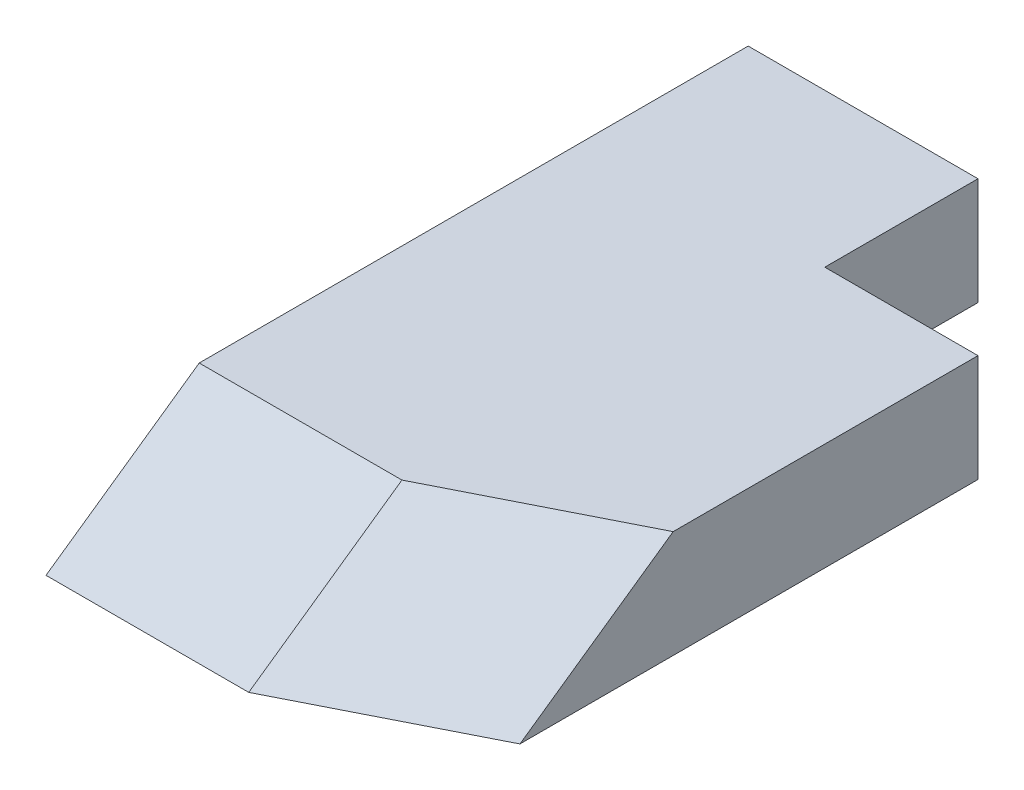
from build123d import *

# Parameters (mm, degrees)
BOSS_EXTRUDE1_DEPTH = 15
SKETCH6_R           = 26.898177411
CUT_EXTRUDE2_DEPTH  = 9
SKETCH7_W           = 12
SKETCH7_H           = 12
CUT_EXTRUDE3_DEPTH  = 10


with BuildPart() as part:
    # Sketch1 → Boss-Extrude1 (new, symmetric)
    with BuildSketch(Plane(origin=(0, 0, 0), x_dir=(0, 0, -1), z_dir=(1, 0, 0))):
        Polygon((-28, -7), (15, -7), (15, -15.402490459), (-40, -15.402490459), align=None)
    extrude(amount=BOSS_EXTRUDE1_DEPTH, both=True)

    # Sketch6 → Cut-Extrude2 (cut)
    with BuildSketch(Plane(origin=(2.825070642, 7.997590477, 5.599973139), x_dir=(-0.9605940806562516, 0.22768745094625853, 0.1594284695083218), z_dir=(-0.27795505429506184, -0.7868726049014764, -0.5509741295627175))):
        with Locations((-5.77915715, -31.909329579)):
            Circle(SKETCH6_R)
    extrude(amount=-CUT_EXTRUDE2_DEPTH, mode=Mode.SUBTRACT)

    # Sketch7 → Cut-Extrude3 (cut)
    with BuildSketch(Plane.XZ.offset(15.402490459)):
        with Locations((9, -9)):
            Rectangle(SKETCH7_W, SKETCH7_H)
    extrude(amount=-CUT_EXTRUDE3_DEPTH, mode=Mode.SUBTRACT)


solid = part.part
